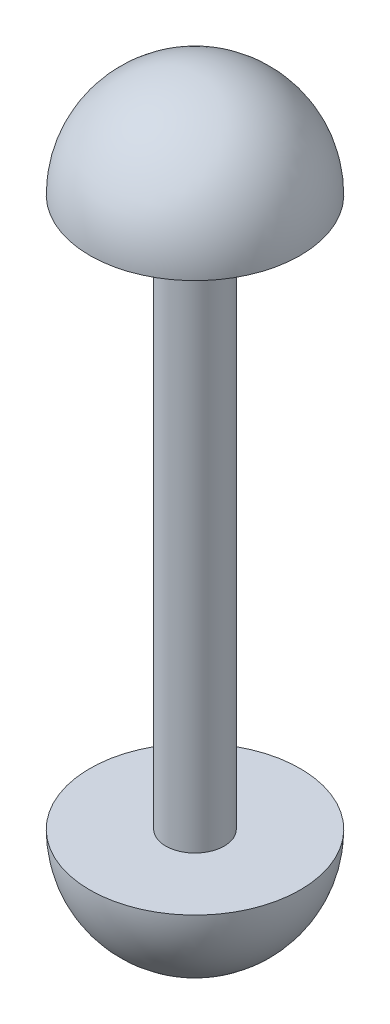
from build123d import *


with BuildPart() as part:
    # Sketch1 → Revolve1 (revolve)
    with BuildSketch(Plane.XY, mode=Mode.PRIVATE) as revolve1_sk:
        with BuildLine():
            Line((-18, 0), (-5, 0))
            Line((-5, 0), (-5, -94))
            Line((-5, -94), (-18, -94))
            ThreePointArc((-18, -94), (-12.727922061, -106.727922061), (0, -112))
            Line((0, -112), (0, 18))
            ThreePointArc((0, 18), (-12.727922061, 12.727922061), (-18, 0))
        make_face()
    revolve(revolve1_sk.sketch.rotate(Axis((0, 18, 0), (0, -1, 0)), 180), axis=Axis((0, 18, 0), (0, -1, 0)))


solid = part.part
